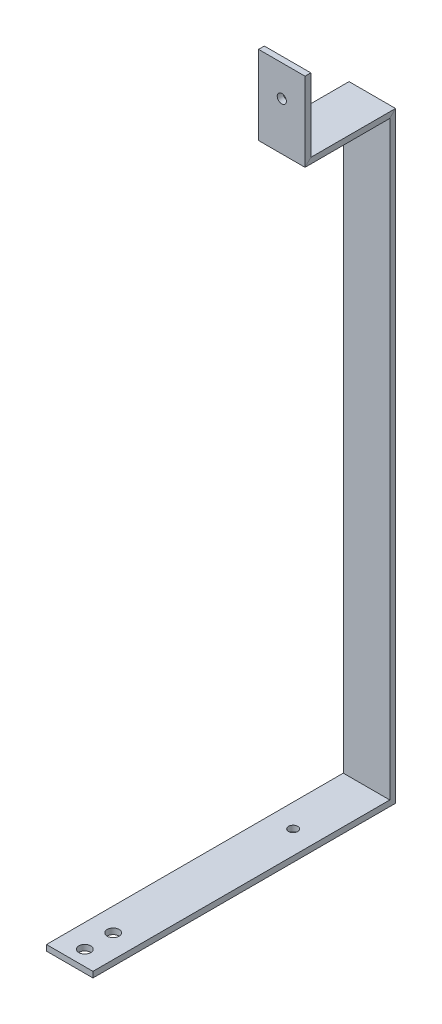
from build123d import *

# Parameters (mm, degrees)
CROQUIS1_W              = 50.8
CROQUIS1_H              = 6.31
SALIENTE_EXTRUIR1_DEPTH = 330.7
CROQUIS3_W              = 50.8
CROQUIS3_H              = 6.31
SALIENTE_EXTRUIR2_DEPTH = 644.51
CROQUIS4_W              = 50.8
CROQUIS4_H              = 6.31
CROQUIS8_R              = 6.5
CORTAR_EXTRUIR2_DEPTH   = 10
CROQUIS10_R             = 5
CORTAR_EXTRUIR4_DEPTH   = 50
CROQUIS11_R             = 5
CORTAR_EXTRUIR5_DEPTH   = 10


with BuildPart() as part:
    # Croquis1 → Saliente-Extruir1 (new body)
    with BuildSketch(Plane.XY):
        Rectangle(CROQUIS1_W, CROQUIS1_H)
    extrude(amount=SALIENTE_EXTRUIR1_DEPTH)

    # Croquis3 → Saliente-Extruir2 (add)
    with BuildSketch(Plane.XZ.offset(3.155)):
        with Locations((0, 3.155)):
            Rectangle(CROQUIS3_W, CROQUIS3_H)
    extrude(amount=-SALIENTE_EXTRUIR2_DEPTH)

    # Barrer1: sweep along a curve in space
    with BuildLine() as barrer1_path:
        Line((0, 641.355, 3.155), (0, 651.355, 3.155))
        Line((0, 651.355, 3.155), (0, 651.355, 95.765))
        Line((0, 651.355, 95.765), (0, 734.515, 95.765))
    # Croquis4 → Barrer1 (sweep)
    with BuildSketch(Plane(origin=(0, 641.355, 0), x_dir=(1, 0, 0), z_dir=(0, 1, 0))):
        with Locations((0, -3.155)):
            Rectangle(CROQUIS4_W, CROQUIS4_H)
    sweep(path=barrer1_path.line, transition=Transition.RIGHT)

    # Croquis8 → Cortar-Extruir2 (cut)
    with BuildSketch(Plane.XZ.offset(3.155)):
        with Locations(Location((0, 314.2, 0), (0, 0, 270))):
            Circle(CROQUIS8_R)
        with Locations(Location((0, 283.2, 0), (0, 0, 270))):
            Circle(CROQUIS8_R)
    extrude(amount=-CORTAR_EXTRUIR2_DEPTH, mode=Mode.SUBTRACT)

    # Croquis10 → Cortar-Extruir4 (cut)
    with BuildSketch(Plane.XY.offset(98.92)):
        with Locations((0, 700.515)):
            Circle(CROQUIS10_R)
    extrude(amount=-CORTAR_EXTRUIR4_DEPTH, mode=Mode.SUBTRACT)

    # Croquis11 → Cortar-Extruir5 (cut)
    with BuildSketch(Plane.XZ.offset(3.155)):
        with Locations(Location((0, 86.51, 0), (0, 0, 270))):
            Circle(CROQUIS11_R)
    extrude(amount=-CORTAR_EXTRUIR5_DEPTH, mode=Mode.SUBTRACT)


solid = part.part
